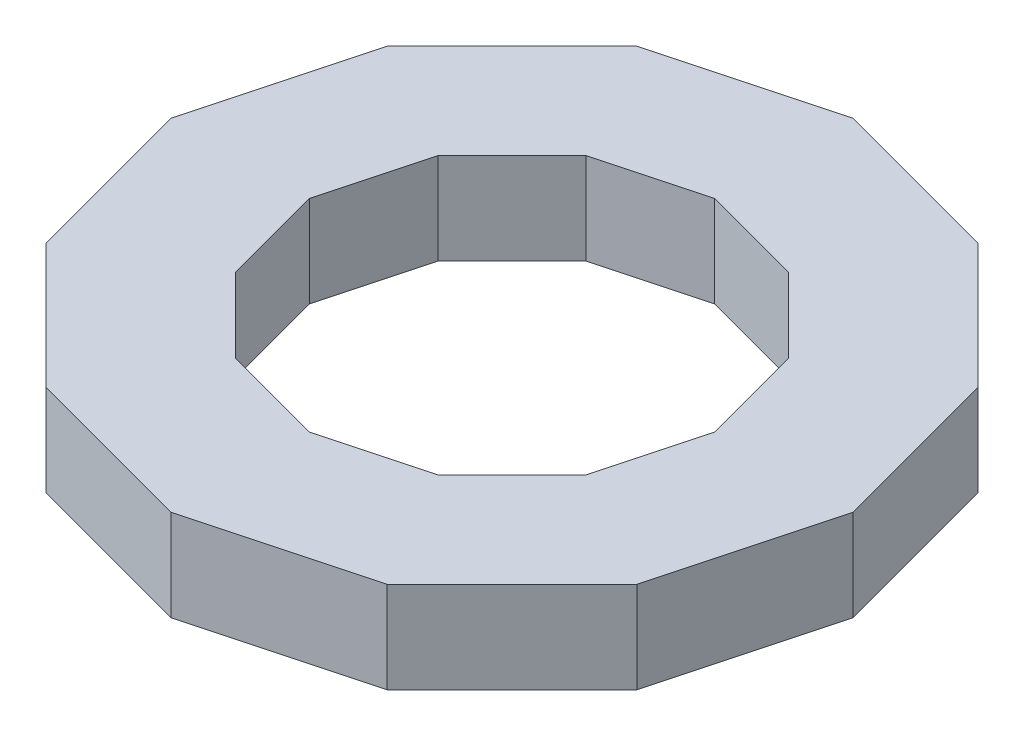
from build123d import *

# Parameters (mm, degrees)
BOSS_EXTRUDE1_DEPTH = 19.05


with BuildPart() as part:
    # Sketch1 → Boss-Extrude1 (new body)
    with BuildSketch(Plane(origin=(0, 0, 0), x_dir=(1, 0, 0), z_dir=(0, 1, 0))):
        Polygon((71.150096364, 0), (61.617790933, 35.575048182), (35.575048182, 61.617790933), (0, 71.150096364), (-35.575048182, 61.617790933), (-61.617790933, 35.575048182), (-71.150096364, 0), (-61.617790933, -35.575048182), (-35.575048182, -61.617790933), (0, -71.150096364), (35.575048182, -61.617790933), (61.617790933, -35.575048182), align=None)
        Polygon((42.224479884, 0), (36.567472241, 21.112239942), (21.112239942, 36.567472241), (0, 42.224479884), (-21.112239942, 36.567472241), (-36.567472241, 21.112239942), (-42.224479884, 0), (-36.567472241, -21.112239942), (-21.112239942, -36.567472241), (0, -42.224479884), (21.112239942, -36.567472241), (36.567472241, -21.112239942), align=None, mode=Mode.SUBTRACT)
    extrude(amount=BOSS_EXTRUDE1_DEPTH)


solid = part.part
